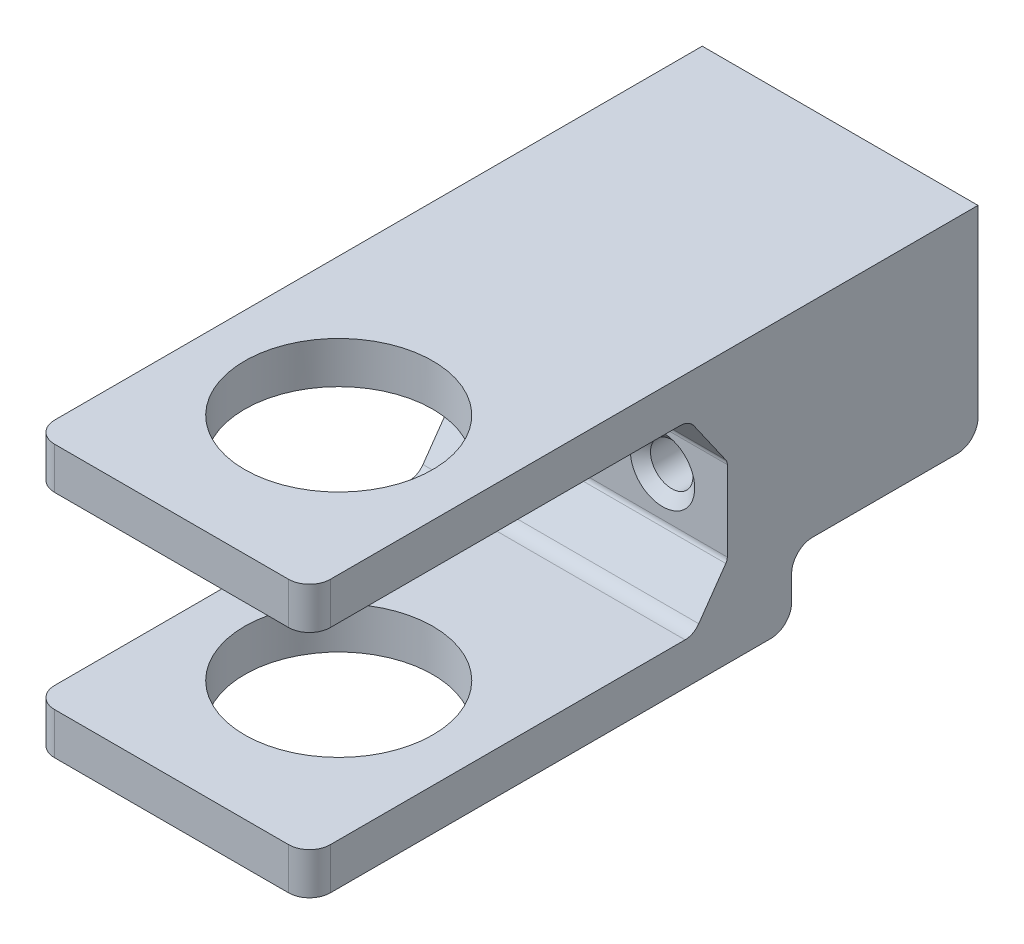
from build123d import *

# Parameters (mm, degrees)
SKETCH1_W                                          = 41.91
SKETCH1_H                                          = 101.6
BOSS_EXTRUDE1_DEPTH                                = 41.275
CUT_EXTRUDE6_DEPTH                                 = 78.72202857
SKETCH3_R                                          = 14.3002
CUT_EXTRUDE2_DEPTH                                 = 69.726833551
SKETCH17_W                                         = 28.321
SKETCH17_H                                         = 10.16
CUT_EXTRUDE7_DEPTH                                 = 78.72202857
SKETCH4_R                                          = 3.2258
CUT_EXTRUDE3_DEPTH                                 = 112.648097386
FILLET2_R                                          = 3.175
CSK_FOR_10_FLAT_HEAD_MACHINE_SCREW_100_D           = 5.6134
CSK_FOR_10_FLAT_HEAD_MACHINE_SCREW_100_DEPTH       = 38.1
CSK_FOR_10_FLAT_HEAD_MACHINE_SCREW_100_CSINK_D     = 9.779
CSK_FOR_10_FLAT_HEAD_MACHINE_SCREW_100_CSINK_ANGLE = 100
CSK_FOR_10_FLAT_HEAD_MACHINE_SCREW_100_TIP         = 1.686435499
FILLET3_R                                          = 2.54
FILLET4_R                                          = 1.27


with BuildPart() as part:
    # Sketch1 → Boss-Extrude1 (new body)
    with BuildSketch(Plane(origin=(0, 0, 0), x_dir=(1, 0, 0), z_dir=(0, 1, 0))):
        Rectangle(SKETCH1_W, SKETCH1_H)
    extrude(amount=BOSS_EXTRUDE1_DEPTH)

    # Sketch13 → Cut-Extrude6 (cut, through all)
    with BuildSketch(Plane.ZY.offset(20.955)):
        Polygon((-6.872463407, 34.925), (-12.7, 26.60241523), (-12.7, 13.632261674), (-7.600905481, 6.35), (50.8, 6.35), (50.8, 34.925), align=None)
    extrude(amount=-CUT_EXTRUDE6_DEPTH, mode=Mode.SUBTRACT)

    # Sketch3 → Cut-Extrude2 (cut, through all)
    # profile 1 of 2: a face of its own
    with BuildSketch(Plane(origin=(0, 41.275, 0), x_dir=(1, 0, 0), z_dir=(0, 1, 0))):
        with Locations(Location((0, -25.4, 0), (0, 0, 270))):
            Circle(SKETCH3_R)
        Polygon((5.499261314, -25.4), (2.749630657, -20.6375), (-2.749630657, -20.6375), (-5.499261314, -25.4), (-2.749630657, -30.1625), (2.749630657, -30.1625), align=None, mode=Mode.SUBTRACT)
    # profile 2 of 2: a face of its own
    with BuildSketch(Plane(origin=(0, 41.275, 0), x_dir=(1, 0, 0), z_dir=(0, 1, 0))):
        Polygon((2.749630657, -30.1625), (5.499261314, -25.4), (2.749630657, -20.6375), (-2.749630657, -20.6375), (-5.499261314, -25.4), (-2.749630657, -30.1625), align=None)
    extrude(amount=-CUT_EXTRUDE2_DEPTH, mode=Mode.SUBTRACT)

    # Sketch17 → Cut-Extrude7 (cut, through all)
    with BuildSketch(Plane.ZY.offset(20.955)):
        with Locations((-36.6395, 5.08)):
            Rectangle(SKETCH17_W, SKETCH17_H)
    extrude(amount=-CUT_EXTRUDE7_DEPTH, mode=Mode.SUBTRACT)

    # Sketch4 → Cut-Extrude3 (cut, through all)
    with BuildSketch(Plane(origin=(0, 0, -50.8), x_dir=(-1, 0, 0), z_dir=(0, 0, -1))):
        with Locations((11.1125, 20.6375)):
            Circle(SKETCH4_R)
        with Locations((-11.1125, 20.6375)):
            Circle(SKETCH4_R)
    extrude(amount=-CUT_EXTRUDE3_DEPTH, mode=Mode.SUBTRACT)

    # Fillet2
    fillet2_edges = [part.edges().sort_by_distance(p)[0] for p in [
        (20.955, 3.175, 50.8),
        (-20.955, 3.175, 50.8),
        (0, 10.16, -50.8),
        (0, 10.16, -22.479),
        (0, 0, -22.479),
        (20.955, 38.1, 50.8),
        (-20.955, 38.1, 50.8),
    ]]
    fillet(fillet2_edges, radius=FILLET2_R)

    # CSK for #10 Flat Head Machine Screw (100)4
    with Locations(Plane.XY.offset(-12.7)):
        with Locations((-11.1125, 20.6375), (11.1125, 20.6375)):
            CounterSinkHole(CSK_FOR_10_FLAT_HEAD_MACHINE_SCREW_100_D / 2, CSK_FOR_10_FLAT_HEAD_MACHINE_SCREW_100_CSINK_D / 2, depth=CSK_FOR_10_FLAT_HEAD_MACHINE_SCREW_100_DEPTH, counter_sink_angle=CSK_FOR_10_FLAT_HEAD_MACHINE_SCREW_100_CSINK_ANGLE)
            with Locations((0, 0, -(CSK_FOR_10_FLAT_HEAD_MACHINE_SCREW_100_DEPTH + CSK_FOR_10_FLAT_HEAD_MACHINE_SCREW_100_TIP / 2))):  # 118° drill point
                Cone(0, CSK_FOR_10_FLAT_HEAD_MACHINE_SCREW_100_D / 2, CSK_FOR_10_FLAT_HEAD_MACHINE_SCREW_100_TIP, mode=Mode.SUBTRACT)

    # Fillet3
    fillet3_edges = [part.edges().sort_by_distance(p)[0] for p in [
        (0, 34.925, -6.872463407),
        (0, 6.35, -7.600905481),
    ]]
    fillet(fillet3_edges, radius=FILLET3_R)

    # Fillet4
    fillet4_edges = [part.edges().sort_by_distance(p)[0] for p in [
        (0, 13.632261674, -12.7),
        (0, 26.60241523, -12.7),
    ]]
    fillet(fillet4_edges, radius=FILLET4_R)


solid = part.part
